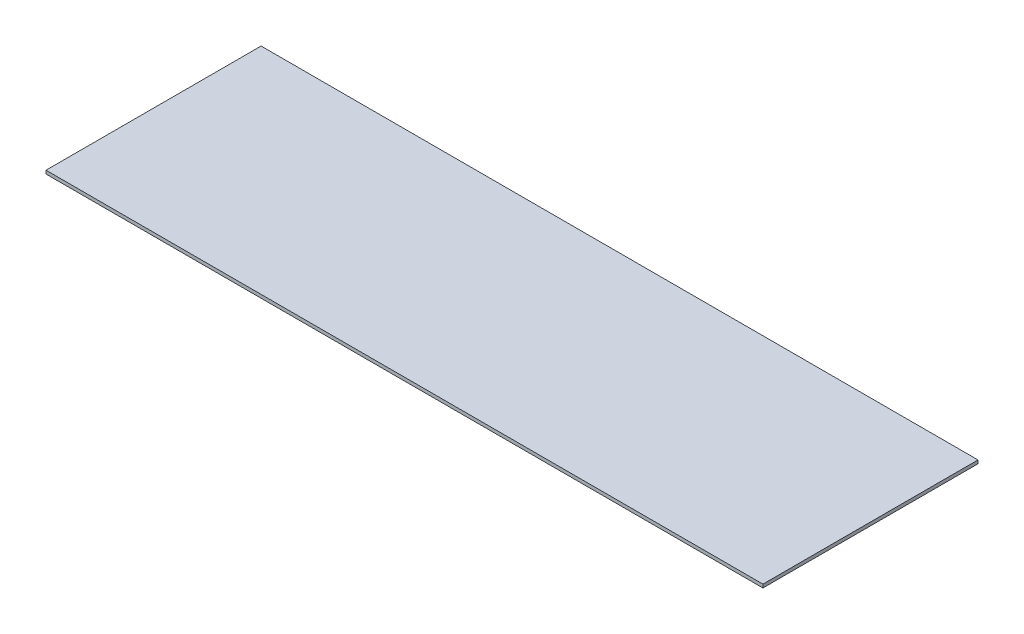
from build123d import *

# Parameters (mm, degrees)
SKETCH1_W           = 1016
SKETCH1_H           = 304.8
BOSS_EXTRUDE1_DEPTH = 4.7625


with BuildPart() as part:
    # Sketch1 → Boss-Extrude1 (new body)
    with BuildSketch(Plane(origin=(0, 0, 0), x_dir=(1, 0, 0), z_dir=(0, 1, 0))):
        with Locations((508, 152.4)):
            Rectangle(SKETCH1_W, SKETCH1_H)
    extrude(amount=BOSS_EXTRUDE1_DEPTH)


solid = part.part
